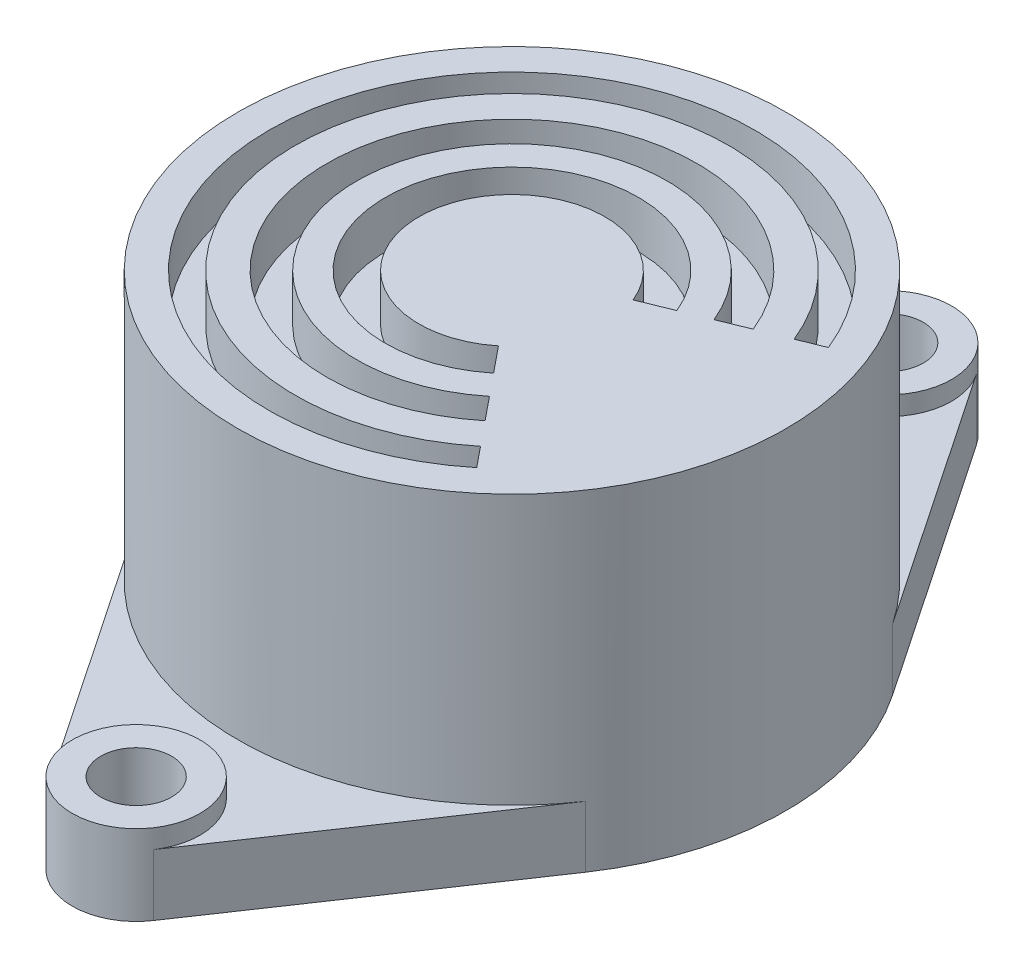
from build123d import *
from build123d.topology import SkipClean

# Parameters (mm, degrees)
SKETCH1_R           = 14.732
BOSS_EXTRUDE1_DEPTH = 14.478
BOSS_EXTRUDE2_START = 3.302
SKETCH2_R           = 1.905
BOSS_EXTRUDE2_DEPTH = 3.302
SKETCH3_R           = 3.429
SKETCH3_R_2         = 1.905
BOSS_EXTRUDE3_DEPTH = 1.016
CUT_EXTRUDE1_DEPTH  = 2.54


with BuildPart() as part:
    # Sketch1 → Boss-Extrude1 (new body)
    with BuildSketch(Plane(origin=(0, 0, 0), x_dir=(1, 0, 0), z_dir=(0, 1, 0))):
        with Locations(Location((0, 0, 0), (0, 0, 270))):
            Circle(SKETCH1_R)
    extrude(amount=BOSS_EXTRUDE1_DEPTH)

    # Sketch2 → Boss-Extrude2 (add)
    with SkipClean():  # the faces are left unmerged after this step: merging them gives an invalid solid
        with BuildSketch(Plane.XZ.offset(BOSS_EXTRUDE2_START)):
            with BuildLine():
                Line((12.207857362, 8.246213836), (2.841484041, 22.112377358))
                ThreePointArc((2.841484041, 22.112377358), (0, 23.622), (-2.841484041, 22.112377358))
                Line((-2.841484041, 22.112377358), (-12.207857362, 8.246213836))
                ThreePointArc((-12.207857362, 8.246213836), (-14.732, 0), (-12.207857362, -8.246213836))
                Line((-12.207857362, -8.246213836), (-2.841484041, -22.112377358))
                ThreePointArc((-2.841484041, -22.112377358), (0, -23.622), (2.841484041, -22.112377358))
                Line((2.841484041, -22.112377358), (12.207857362, -8.246213836))
                ThreePointArc((12.207857362, -8.246213836), (14.732, 0), (12.207857362, 8.246213836))
            make_face()
            with Locations(Location((0, -20.193, 0), (0, 0, 90))):
                Circle(SKETCH2_R, mode=Mode.SUBTRACT)
            with Locations(Location((0, 20.193, 0), (0, 0, 90))):
                Circle(SKETCH2_R, mode=Mode.SUBTRACT)
        extrude(amount=-BOSS_EXTRUDE2_DEPTH)

    # Sketch3 → Boss-Extrude3 (add)
    # profile 1 of 2: a face of its own
    with SkipClean():  # the faces are left unmerged after this step: merging them gives an invalid solid
        with BuildSketch(Plane(origin=(0, 0, 0), x_dir=(1, 0, 0), z_dir=(0, 1, 0))):
            with Locations(Location((0, 20.193, 0), (0, 0, 270))):
                Circle(SKETCH3_R)
            with Locations(Location((0, 20.193, 0), (0, 0, 270))):
                Circle(SKETCH3_R_2, mode=Mode.SUBTRACT)
        # profile 2 of 2: a face of its own
        with BuildSketch(Plane(origin=(0, 0, 0), x_dir=(1, 0, 0), z_dir=(0, 1, 0))):
            with Locations(Location((0, -20.193, 0), (0, 0, 270))):
                Circle(SKETCH3_R)
            with Locations(Location((0, -20.193, 0), (0, 0, 270))):
                Circle(SKETCH3_R_2, mode=Mode.SUBTRACT)
        extrude(amount=BOSS_EXTRUDE3_DEPTH)

    # Sketch4 → Cut-Extrude1 (cut)
    with SkipClean():  # the faces are left unmerged after this step: merging them gives an invalid solid
        with BuildSketch(Plane(origin=(0, 14.478, 0), x_dir=(1, 0, 0), z_dir=(0, 1, 0))):
            with BuildLine():
                Line((4.627366212, 1.879749362), (6.299197436, 2.558888105))
                ThreePointArc((6.299197436, 2.558888105), (-6.58577895, 1.689766936), (4.289039466, -5.275598272))
                Line((4.289039466, -5.275598272), (3.150711898, -3.875434203))
                ThreePointArc((3.150711898, -3.875434203), (-4.83788789, 1.241296293), (4.627366212, 1.879749362))
            make_face()
            with BuildLine():
                Line((5.257301605, -6.466578702), (6.277197533, -7.721069653))
                ThreePointArc((6.277197533, -7.721069653), (-9.638576586, 2.473048086), (9.219151961, 3.745045069))
                Line((9.219151961, 3.745045069), (7.721258116, 3.136563944))
                ThreePointArc((7.721258116, 3.136563944), (-8.072536174, 2.071236345), (5.257301605, -6.466578702))
            make_face()
            with BuildLine():
                Line((7.342672007, -9.031623062), (8.233849794, -10.127788306))
                ThreePointArc((8.233849794, -10.127788306), (-12.64299736, 3.243916791), (12.092834753, 4.912405322))
                Line((12.092834753, 4.912405322), (10.783985796, 4.380718855))
                ThreePointArc((10.783985796, 4.380718855), (-11.274602419, 2.892816557), (7.342672007, -9.031623062))
            make_face()
        extrude(amount=-CUT_EXTRUDE1_DEPTH, mode=Mode.SUBTRACT)


solid = part.part
